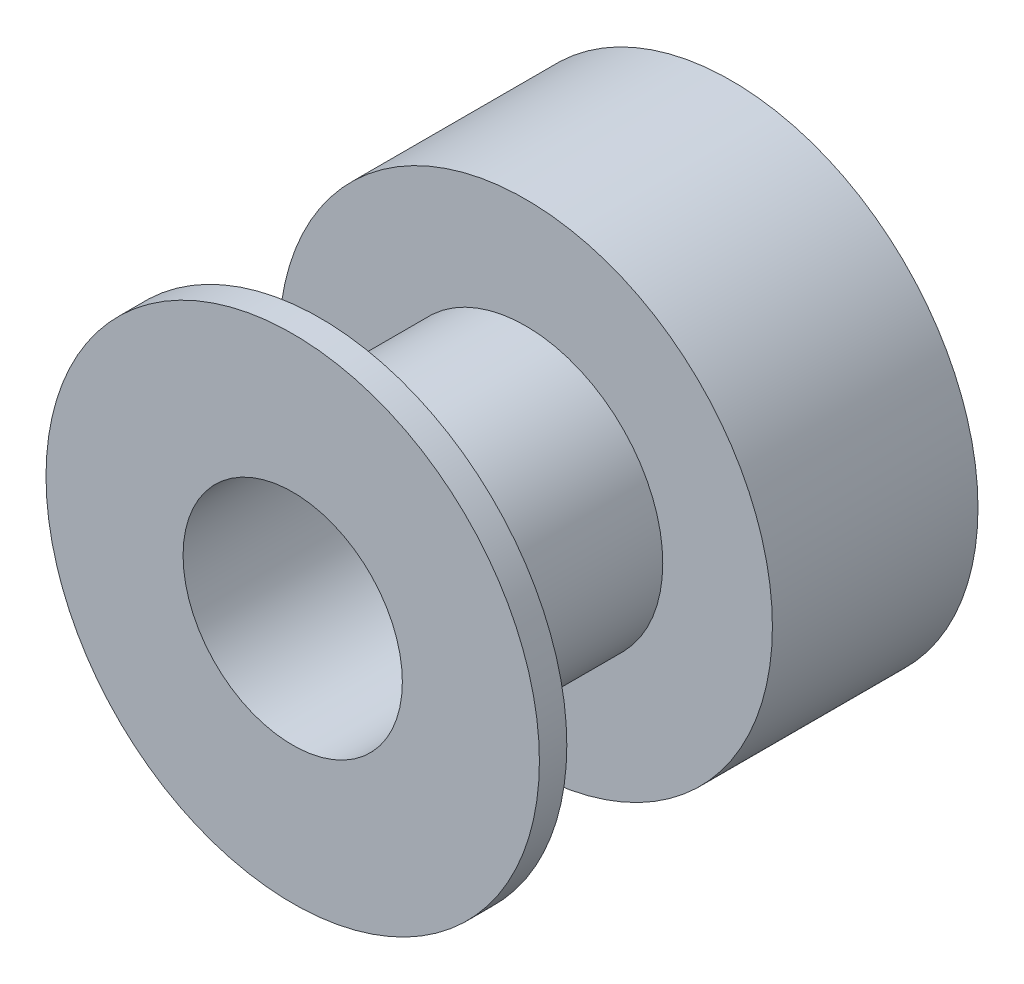
from build123d import *

# Parameters (mm, degrees)
SKETCH1_R           = 9
BOSS_EXTRUDE1_DEPTH = 7.5
SKETCH2_R           = 5
BOSS_EXTRUDE2_DEPTH = 7.5
SKETCH3_R           = 9
BOSS_EXTRUDE3_DEPTH = 1
SKETCH4_R           = 4
CUT_EXTRUDE1_DEPTH  = 20


with BuildPart() as part:
    # Sketch1 → Boss-Extrude1 (new body)
    with BuildSketch(Plane.XY):
        Circle(SKETCH1_R)
    extrude(amount=BOSS_EXTRUDE1_DEPTH)

    # Sketch2 → Boss-Extrude2 (add)
    with BuildSketch(Plane.XY.offset(7.5)):
        Circle(SKETCH2_R)
    extrude(amount=BOSS_EXTRUDE2_DEPTH)

    # Sketch3 → Boss-Extrude3 (add)
    with BuildSketch(Plane.XY.offset(15)):
        Circle(SKETCH3_R)
    extrude(amount=BOSS_EXTRUDE3_DEPTH)

    # Sketch4 → Cut-Extrude1 (cut)
    with BuildSketch(Plane(origin=(0, 0, 0), x_dir=(-1, 0, 0), z_dir=(0, 0, -1))):
        Circle(SKETCH4_R)
    extrude(amount=-CUT_EXTRUDE1_DEPTH, mode=Mode.SUBTRACT)


solid = part.part
